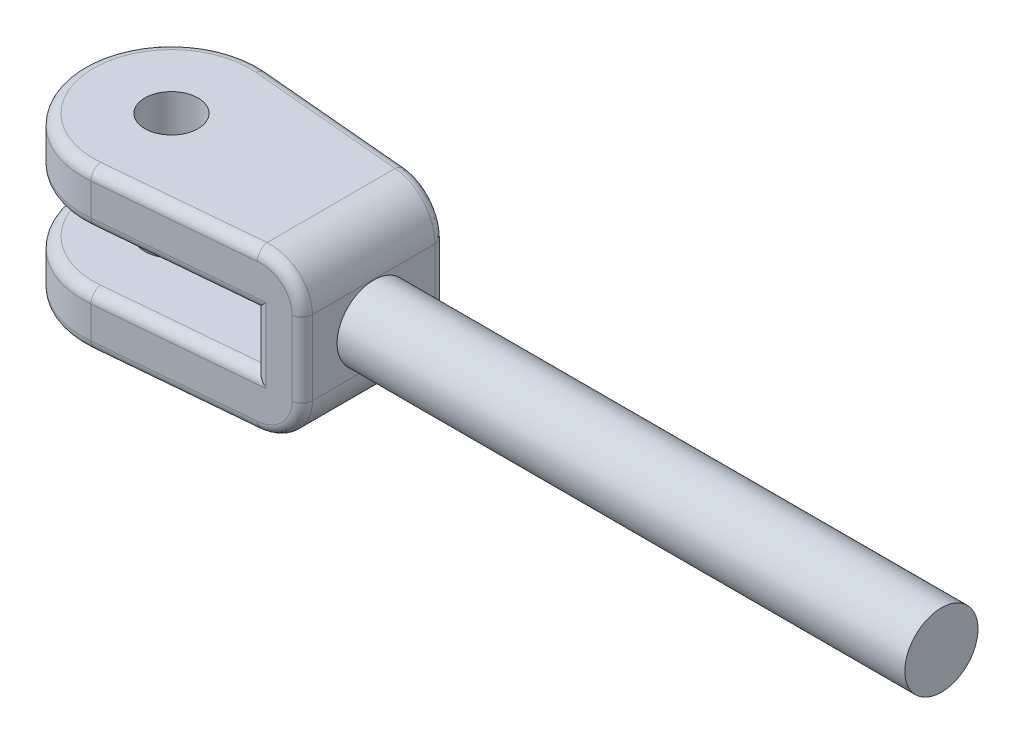
from build123d import *

# Parameters (mm, degrees)
SKETCH4_R               = 2.619375
BOSS_EXTRUDE2_DEPTH     = 40.64
BOSS_EXTRUDE4_DEPTH     = 5.715
CUT_EXTRUDE2_DEPTH      = 43.16105899
CUT_EXTRUDE2_DEPTH_BACK = 43.16105899
SKETCH16_W              = 25.774361669
SKETCH16_H              = 3.81
CUT_EXTRUDE3_DEPTH      = 43.691650237
CUT_EXTRUDE3_DEPTH_BACK = 43.691650237
SKETCH17_R              = 1.905
FILLET1_R               = 3.048
FILLET2_R               = 0.762
SCALE1_SCALE            = 6


with BuildPart() as part:
    # Sketch4 → Boss-Extrude2 (new body)
    with BuildSketch(Plane(origin=(0, 0, 0), x_dir=(0, 0, -1), z_dir=(1, 0, 0))):
        Circle(SKETCH4_R)
    extrude(amount=BOSS_EXTRUDE2_DEPTH)

    # Sketch13 → Boss-Extrude4 (add, symmetric)
    with BuildSketch(Plane(origin=(0, 0, 0), x_dir=(1, 0, 0), z_dir=(0, 1, 0))):
        with BuildLine():
            Line((0, 5.08), (0, -5.08))
            Line((0, -5.08), (-13.91443545, -6.324743387))
            ThreePointArc((-13.91443545, -6.324743387), (-20.830227899, 0), (-13.91443545, 6.324743387))
            Line((-13.91443545, 6.324743387), (0, 5.08))
        make_face()
    extrude(amount=BOSS_EXTRUDE4_DEPTH, both=True)

    # Sketch16 → Cut-Extrude2 (cut, two sides: drawn at the far end of the back side and taken through both)
    with BuildSketch(Plane(origin=(0.450833644, 0, 5.039669783), x_dir=(0.996022580554145, 0, -0.08910117297915686), z_dir=(0.08910117297915686, 0, 0.996022580554145)).offset(-CUT_EXTRUDE2_DEPTH_BACK)):
        with Locations((-16.514814794, 0)):
            Rectangle(SKETCH16_W, SKETCH16_H)
    extrude(amount=CUT_EXTRUDE2_DEPTH + CUT_EXTRUDE2_DEPTH_BACK, mode=Mode.SUBTRACT)

    # Sketch17 → Cut-Extrude3 (cut, two sides: drawn at the far end of the back side and taken through both)
    with BuildSketch(Plane.XZ.offset(5.715).offset(-CUT_EXTRUDE3_DEPTH_BACK)):
        with Locations(Location((-14.480227899, 0, 0), (0, 0, 270))):
            Circle(SKETCH17_R)
    extrude(amount=CUT_EXTRUDE3_DEPTH + CUT_EXTRUDE3_DEPTH_BACK, mode=Mode.SUBTRACT)

    # Fillet1
    fillet1_edges = [part.edges().sort_by_distance(p)[0] for p in [
        (0, -5.715, 0),
        (0, 5.715, 0),
    ]]
    fillet(fillet1_edges, radius=FILLET1_R)

    # Fillet2
    fillet2_edges = [part.edges().sort_by_distance(p)[0] for p in [
        (-8.538403572, -1.905, 5.843819805),
        (-3.162371693, 0, 5.362896224),
        (-8.538403572, 1.905, 5.843819805),
        (-9.02202226, 1.905, -5.887082873),
        (-20.830227899, 1.905, 0),
        (-4.12960907, 0, -5.44942236),
        (-20.830227899, -1.905, 0),
        (-9.02202226, -1.905, -5.887082873),
        (0, 0, -5.08),
        (0, 0, 5.08),
        (-8.481217725, 5.715, -5.838704132),
        (-8.481217725, -5.715, -5.838704132),
        (-0.894886956, 4.824407754, -5.160053885),
        (-0.894886956, -4.824407754, -5.160053885),
        (-0.894886956, 4.824407754, 5.160053885),
        (-0.894886956, -4.824407754, 5.160053885),
        (-20.830227899, -5.715, 0),
        (-8.481217725, -5.715, 5.838704132),
        (-20.830227899, 5.715, 0),
        (-8.481217725, 5.715, 5.838704132),
    ]]
    fillet(fillet2_edges, radius=FILLET2_R)


with BuildPart() as part_1:
    # Scale1: scaled about (0.503603853, 0, -0.013653442)
    add(part.part.scale(SCALE1_SCALE).moved(Location((-2.518019265, 0, 0.06826721))))


solid = part_1.part
